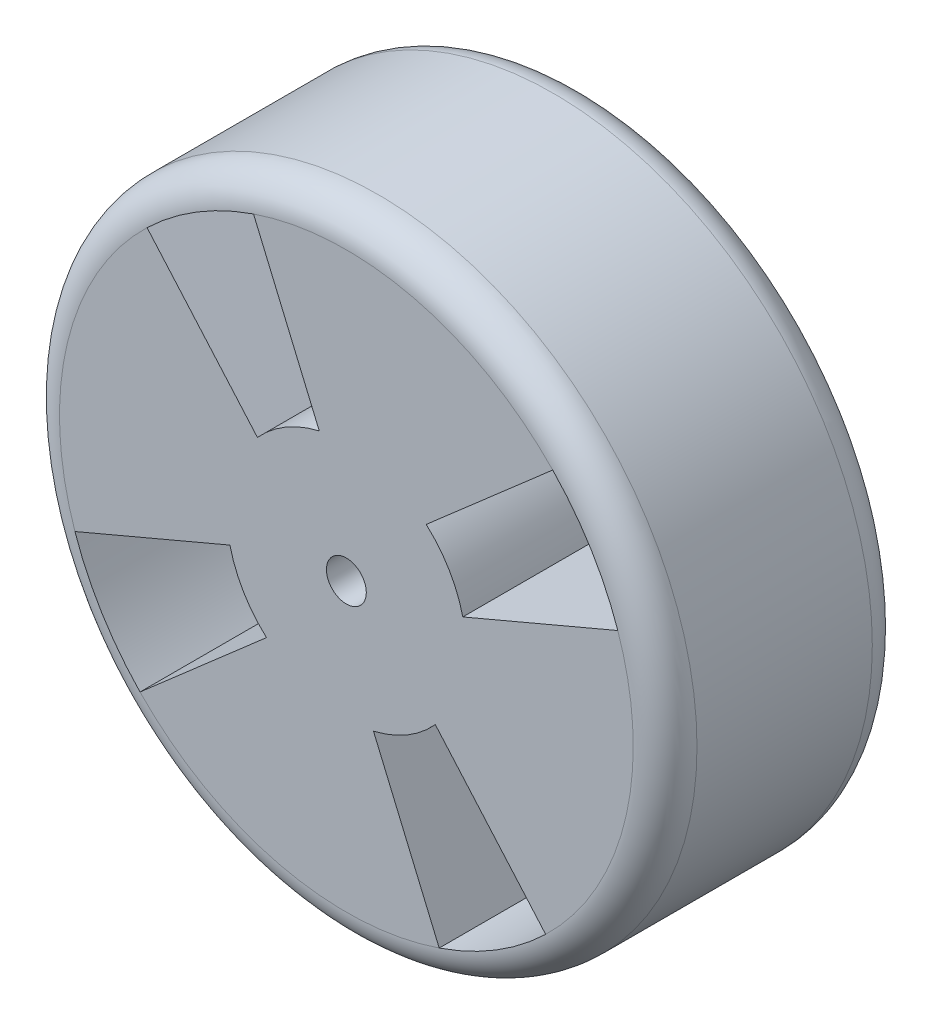
from build123d import *

# Parameters (mm, degrees)
SKETCH2_R           = 101.6
BOSS_EXTRUDE1_DEPTH = 76.2
FILLET1_R           = 10.16
CUT_EXTRUDE1_REACH  = 164.639
SKETCH3_R           = 6.35
CUT_EXTRUDE2_REACH  = 164.639


with BuildPart() as part:
    # Sketch2 → Boss-Extrude1 (new body)
    with BuildSketch(Plane.XY):
        Circle(SKETCH2_R)
    extrude(amount=-BOSS_EXTRUDE1_DEPTH)

    # Fillet1
    fillet1_edges = [part.edges().sort_by_distance(p)[0] for p in [
        (-101.6, 0, 0),
        (-101.6, 0, -76.2),
    ]]
    fillet(fillet1_edges, radius=FILLET1_R)

    # Sketch3 → Cut-Extrude1 (cut, up to next)
    with BuildSketch(Plane.XY, mode=Mode.PRIVATE) as cut_extrude1_sk1:
        Circle(SKETCH3_R)
    cut_extrude1_tool1 = extrude(cut_extrude1_sk1.sketch, amount=-CUT_EXTRUDE1_REACH, mode=Mode.PRIVATE) & part.part
    add(cut_extrude1_tool1.solids().sort_by_distance((0, 0, 0))[0], mode=Mode.SUBTRACT)

    # Sketch5 → Cut-Extrude2 (cut, up to next)
    with BuildSketch(Plane.XY, mode=Mode.PRIVATE) as cut_extrude2_sk1:
        with BuildLine():
            Line((65.773312704, 63.522790682), (25.453227454, 28.350365292))
            ThreePointArc((25.453227454, 28.350365292), (32.796836191, 19.390140171), (37.108086442, 8.637124558))
            Line((37.108086442, 8.637124558), (86.518715929, 29.593671518))
            ThreePointArc((86.518715929, 29.593671518), (78.012894947, 47.699704631), (65.773312704, 63.522790682))
        make_face()
    cut_extrude2_tool1 = extrude(cut_extrude2_sk1.sketch, amount=-CUT_EXTRUDE2_REACH, mode=Mode.PRIVATE) & part.part
    # Sketch5 → Cut-Extrude2 (cut, up to next)
    with BuildSketch(Plane.XY, mode=Mode.PRIVATE) as cut_extrude2_sk2:
        with BuildLine():
            Line((63.522790682, -65.773312704), (28.350365292, -25.453227454))
            ThreePointArc((28.350365292, -25.453227454), (19.390140171, -32.796836191), (8.637124558, -37.108086442))
            Line((8.637124558, -37.108086442), (29.593671518, -86.518715929))
            ThreePointArc((29.593671518, -86.518715929), (47.699704631, -78.012894947), (63.522790682, -65.773312704))
        make_face()
    cut_extrude2_tool2 = extrude(cut_extrude2_sk2.sketch, amount=-CUT_EXTRUDE2_REACH, mode=Mode.PRIVATE) & part.part
    # Sketch5 → Cut-Extrude2 (cut, up to next)
    with BuildSketch(Plane.XY, mode=Mode.PRIVATE) as cut_extrude2_sk3:
        with BuildLine():
            Line((-65.773312704, -63.522790682), (-25.453227454, -28.350365292))
            ThreePointArc((-25.453227454, -28.350365292), (-32.796836191, -19.390140171), (-37.108086442, -8.637124558))
            Line((-37.108086442, -8.637124558), (-86.518715929, -29.593671518))
            ThreePointArc((-86.518715929, -29.593671518), (-78.012894947, -47.699704631), (-65.773312704, -63.522790682))
        make_face()
    cut_extrude2_tool3 = extrude(cut_extrude2_sk3.sketch, amount=-CUT_EXTRUDE2_REACH, mode=Mode.PRIVATE) & part.part
    # Sketch5 → Cut-Extrude2 (cut, up to next)
    with BuildSketch(Plane.XY, mode=Mode.PRIVATE) as cut_extrude2_sk4:
        with BuildLine():
            Line((-63.522790682, 65.773312704), (-28.350365292, 25.453227454))
            ThreePointArc((-28.350365292, 25.453227454), (-19.390140171, 32.796836191), (-8.637124558, 37.108086442))
            Line((-8.637124558, 37.108086442), (-29.593671518, 86.518715929))
            ThreePointArc((-29.593671518, 86.518715929), (-47.699704631, 78.012894947), (-63.522790682, 65.773312704))
        make_face()
    cut_extrude2_tool4 = extrude(cut_extrude2_sk4.sketch, amount=-CUT_EXTRUDE2_REACH, mode=Mode.PRIVATE) & part.part
    add(cut_extrude2_tool1.solids().sort_by_distance((56.84773, 34.461957, 0))[0], mode=Mode.SUBTRACT)
    add(cut_extrude2_tool2.solids().sort_by_distance((34.461957, -56.84773, 0))[0], mode=Mode.SUBTRACT)
    add(cut_extrude2_tool3.solids().sort_by_distance((-56.84773, -34.461957, 0))[0], mode=Mode.SUBTRACT)
    add(cut_extrude2_tool4.solids().sort_by_distance((-34.461957, 56.84773, 0))[0], mode=Mode.SUBTRACT)


solid = part.part
